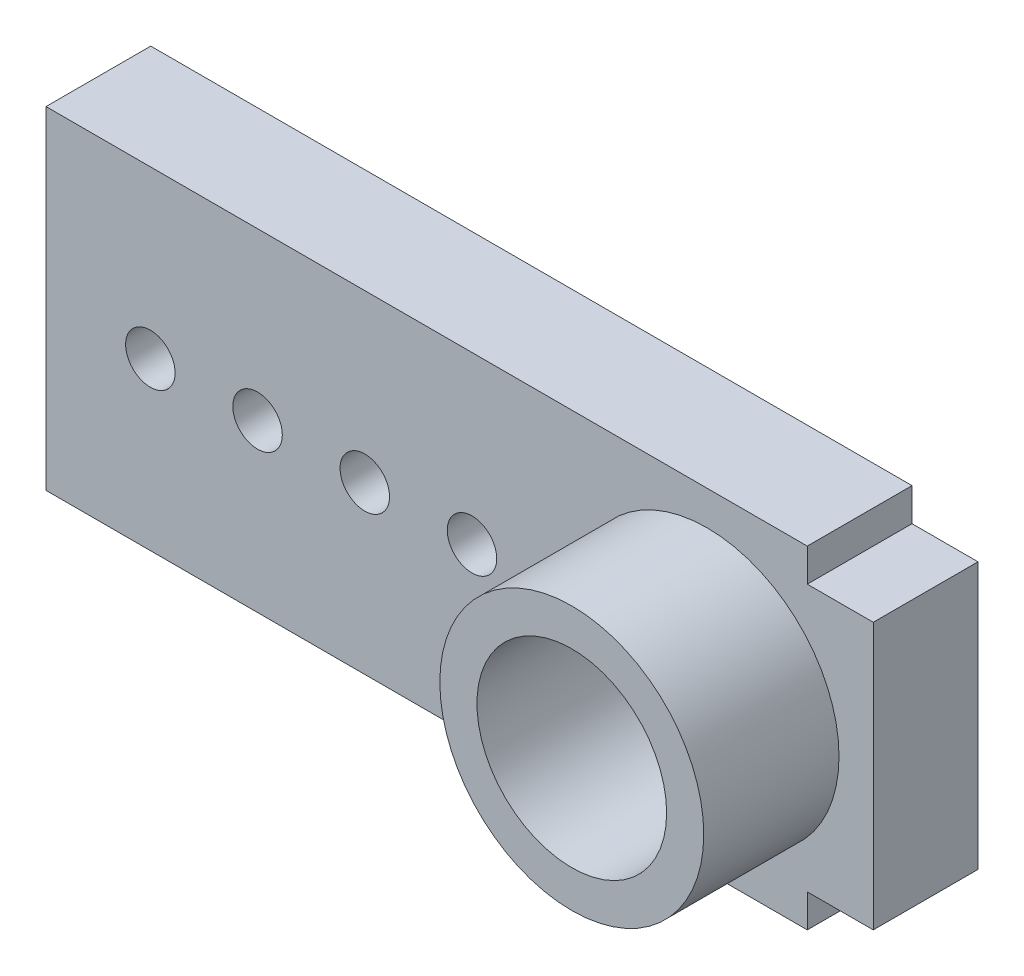
from build123d import *

# Parameters (mm, degrees)
SKETCH1_R           = 2.875
SKETCH1_R_2         = 0.75
BOSS_EXTRUDE1_DEPTH = 3.175
SKETCH2_R           = 4
SKETCH2_R_2         = 2.875
BOSS_EXTRUDE2_DEPTH = 4.1
CUT_EXTRUDE1_DEPTH  = 30.25712561


with BuildPart() as part:
    # Sketch1 → Boss-Extrude1 (new body)
    with BuildSketch(Plane.XY):
        Polygon((-5.038135816, 5.038135816), (-5.038135816, 20.038135816), (5.038135816, 20.038135816), (5.038135816, 5.038135816), (20.038135816, 5.038135816), (20.038135816, -5.038135816), (5.038135816, -5.038135816), (5.038135816, -20.038135816), (-5.038135816, -20.038135816), (-5.038135816, -5.038135816), (-20.038135816, -5.038135816), (-20.038135816, 5.038135816), align=None)
        Circle(SKETCH1_R, mode=Mode.SUBTRACT)
        with Locations((0, 7.125)):
            Circle(SKETCH1_R_2, mode=Mode.SUBTRACT)
        with Locations((0, 10.375)):
            Circle(SKETCH1_R_2, mode=Mode.SUBTRACT)
        with Locations((0, 13.625)):
            Circle(SKETCH1_R_2, mode=Mode.SUBTRACT)
        with Locations((0, 16.875)):
            Circle(SKETCH1_R_2, mode=Mode.SUBTRACT)
        with Locations((7.125, 0)):
            Circle(SKETCH1_R_2, mode=Mode.SUBTRACT)
        with Locations((10.375, 0)):
            Circle(SKETCH1_R_2, mode=Mode.SUBTRACT)
        with Locations((13.625, 0)):
            Circle(SKETCH1_R_2, mode=Mode.SUBTRACT)
        with Locations((16.875, 0)):
            Circle(SKETCH1_R_2, mode=Mode.SUBTRACT)
        with Locations((0, -7.125)):
            Circle(SKETCH1_R_2, mode=Mode.SUBTRACT)
        with Locations((0, -10.375)):
            Circle(SKETCH1_R_2, mode=Mode.SUBTRACT)
        with Locations((0, -13.625)):
            Circle(SKETCH1_R_2, mode=Mode.SUBTRACT)
        with Locations((0, -16.875)):
            Circle(SKETCH1_R_2, mode=Mode.SUBTRACT)
        with Locations((-7.125, 0)):
            Circle(SKETCH1_R_2, mode=Mode.SUBTRACT)
        with Locations((-10.375, 0)):
            Circle(SKETCH1_R_2, mode=Mode.SUBTRACT)
        with Locations((-13.625, 0)):
            Circle(SKETCH1_R_2, mode=Mode.SUBTRACT)
        with Locations((-16.875, 0)):
            Circle(SKETCH1_R_2, mode=Mode.SUBTRACT)
    extrude(amount=BOSS_EXTRUDE1_DEPTH)

    # Sketch2 → Boss-Extrude2 (add)
    with BuildSketch(Plane.XY.offset(3.175)):
        Circle(SKETCH2_R)
        Circle(SKETCH2_R_2, mode=Mode.SUBTRACT)
    extrude(amount=BOSS_EXTRUDE2_DEPTH)

    # Sketch3 → Cut-Extrude1 (cut, through all)
    with BuildSketch(Plane(origin=(0, 0, 0), x_dir=(-1, 0, 0), z_dir=(0, 0, -1))):
        Polygon((-5.038135798, 4.038135816), (-5.038135798, -4.038135816), (-3.038135798, -4.038135816), (-3.038135798, -5.038135816), (5.038135816, -5.038135816), (5.038135816, -21.038135816), (-5.038135816, -21.038135816), (-5.038135816, -5.038135816), (-21.038135816, -5.038135816), (-21.038135816, 5.038135816), (-5.038135816, 5.038135816), (-5.038135816, 21.038135816), (5.038135816, 21.038135816), (5.038135816, 5.038135816), (-3.038135798, 5.038135816), (-3.038135798, 4.038135816), align=None)
    extrude(amount=-CUT_EXTRUDE1_DEPTH, mode=Mode.SUBTRACT)


solid = part.part
